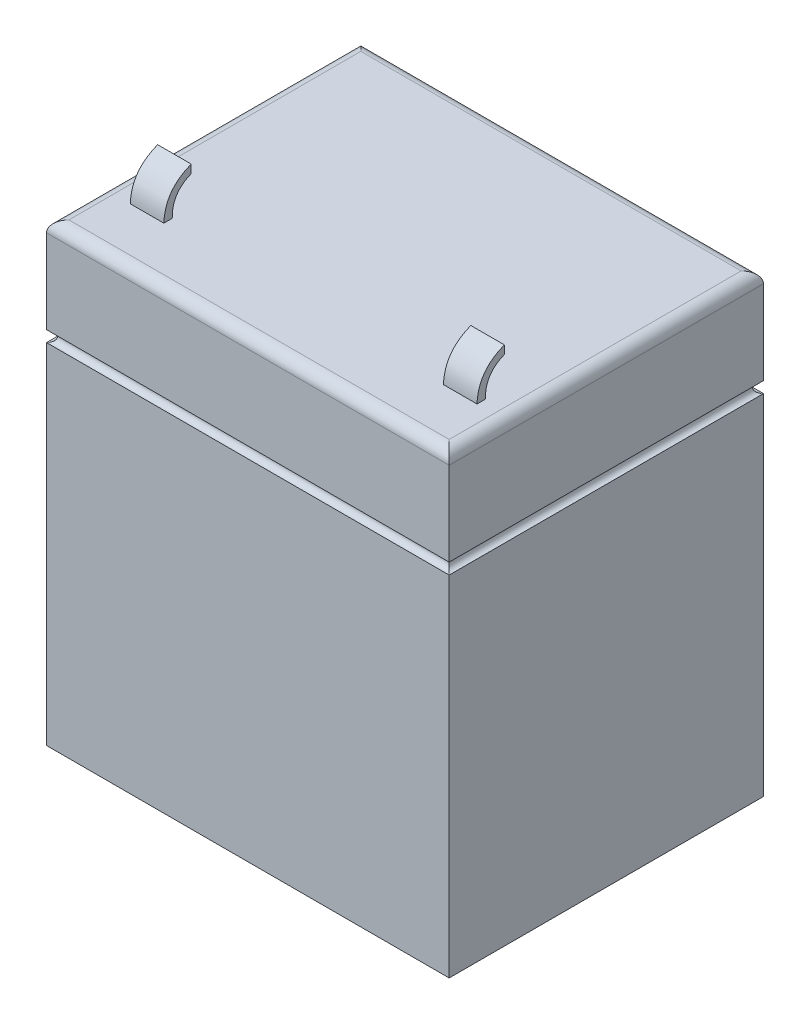
from build123d import *

# Parameters (mm, degrees)
SKETCH1_W               = 91.44
SKETCH1_H               = 71.374
BOSS_EXTRUDE1_DEPTH     = 103.378
BOSS_EXTRUDE2_DEPTH     = 91.44
SKETCH3_W               = 6.35
SKETCH3_H               = 8.525765965
SKETCH3_W_2             = 63.5
CUT_EXTRUDE1_DEPTH      = 162.17684191
FILLET1_R               = 2.54
CUT_EXTRUDE2_DEPTH      = 162.176841809
CUT_EXTRUDE2_DEPTH_BACK = 162.176841809
SKETCH4_R               = 1.27
SKETCH5_R               = 1.27
CUT_EXTRUDE3_DEPTH      = 162.176841809


with BuildPart() as part:
    # Sketch1 → Boss-Extrude1 (new body)
    with BuildSketch(Plane(origin=(0, 0, 0), x_dir=(1, 0, 0), z_dir=(0, 1, 0))):
        with Locations((45.72, 35.687)):
            Rectangle(SKETCH1_W, SKETCH1_H)
    extrude(amount=BOSS_EXTRUDE1_DEPTH)

    # Sketch2 → Boss-Extrude2 (add)
    with BuildSketch(Plane(origin=(91.44, 0, 0), x_dir=(0, 0, -1), z_dir=(1, 0, 0))):
        with BuildLine():
            Line((12.671032171, 103.378), (14.576032171, 103.378))
            add(Edge.make_bspline(
                [(14.576032171, 103.378), (14.461628567, 108.255817866), (18.882181929, 109.998765965)],
                knots=[0, 0, 0, 1, 1, 1], degree=2))
            Line((18.882181929, 109.998765965), (18.882181929, 111.903765965))
            add(Edge.make_bspline(
                [(12.671032171, 103.378), (12.919876826, 109.602255935), (18.882181929, 111.903765965)],
                knots=[0, 0, 0, 1, 1, 1], degree=2))
        make_face()
    extrude(amount=-BOSS_EXTRUDE2_DEPTH)

    # Sketch3 → Cut-Extrude1 (cut, through all)
    with BuildSketch(Plane.XY):
        with Locations((3.175, 107.640882983)):
            Rectangle(SKETCH3_W, SKETCH3_H)
        with Locations((45.72, 107.640882983)):
            Rectangle(SKETCH3_W_2, SKETCH3_H)
        with Locations((88.265, 107.640882983)):
            Rectangle(SKETCH3_W, SKETCH3_H)
    extrude(amount=-CUT_EXTRUDE1_DEPTH, mode=Mode.SUBTRACT)

    # Fillet1
    fillet1_edges = [part.edges().sort_by_distance(p)[0] for p in [
        (91.44, 103.378, -35.687),
        (45.72, 103.378, -71.374),
        (0, 103.378, -35.687),
        (45.72, 103.378, 0),
    ]]
    fillet(fillet1_edges, radius=FILLET1_R)

    # Sketch4 → Cut-Extrude2 (cut, two sides: drawn at the far end of the back side and taken through both)
    with BuildSketch(Plane.ZY.offset(-CUT_EXTRUDE2_DEPTH_BACK)):
        with Locations((-71.374, 80.518)):
            Circle(SKETCH4_R)
        with Locations((0, 80.518)):
            Circle(SKETCH4_R)
    extrude(amount=CUT_EXTRUDE2_DEPTH + CUT_EXTRUDE2_DEPTH_BACK, mode=Mode.SUBTRACT)

    # Sketch5 → Cut-Extrude3 (cut, through all)
    with BuildSketch(Plane.XY):
        with Locations((0, 80.518)):
            Circle(SKETCH5_R)
        with Locations((91.44, 80.518)):
            Circle(SKETCH5_R)
    extrude(amount=-CUT_EXTRUDE3_DEPTH, mode=Mode.SUBTRACT)


solid = part.part
